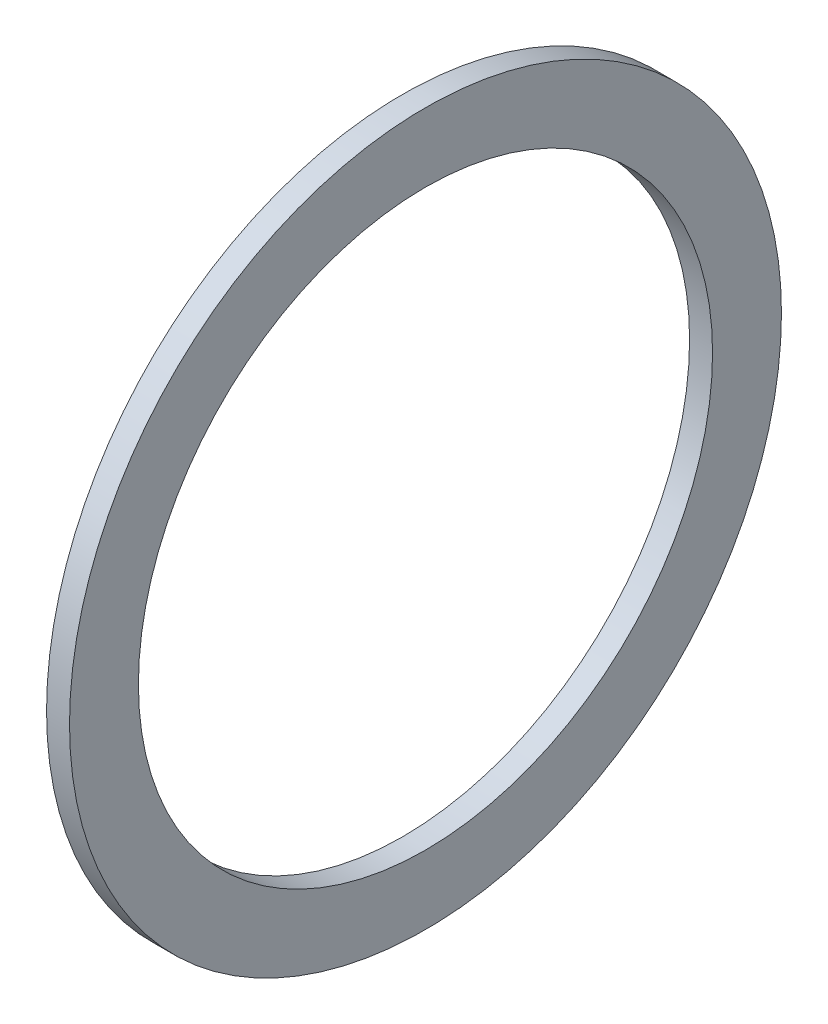
from build123d import *

# Parameters (mm, degrees)
SKETCH2_R           = 49.2125
SKETCH2_R_2         = 39.6875
BOSS_EXTRUDE1_DEPTH = 1.5875


with BuildPart() as part:
    # Sketch2 → Boss-Extrude1 (new, symmetric)
    with BuildSketch(Plane(origin=(0, 0, 0), x_dir=(0, 0, -1), z_dir=(1, 0, 0))):
        Circle(SKETCH2_R)
        Circle(SKETCH2_R_2, mode=Mode.SUBTRACT)
    extrude(amount=BOSS_EXTRUDE1_DEPTH, both=True)


solid = part.part
